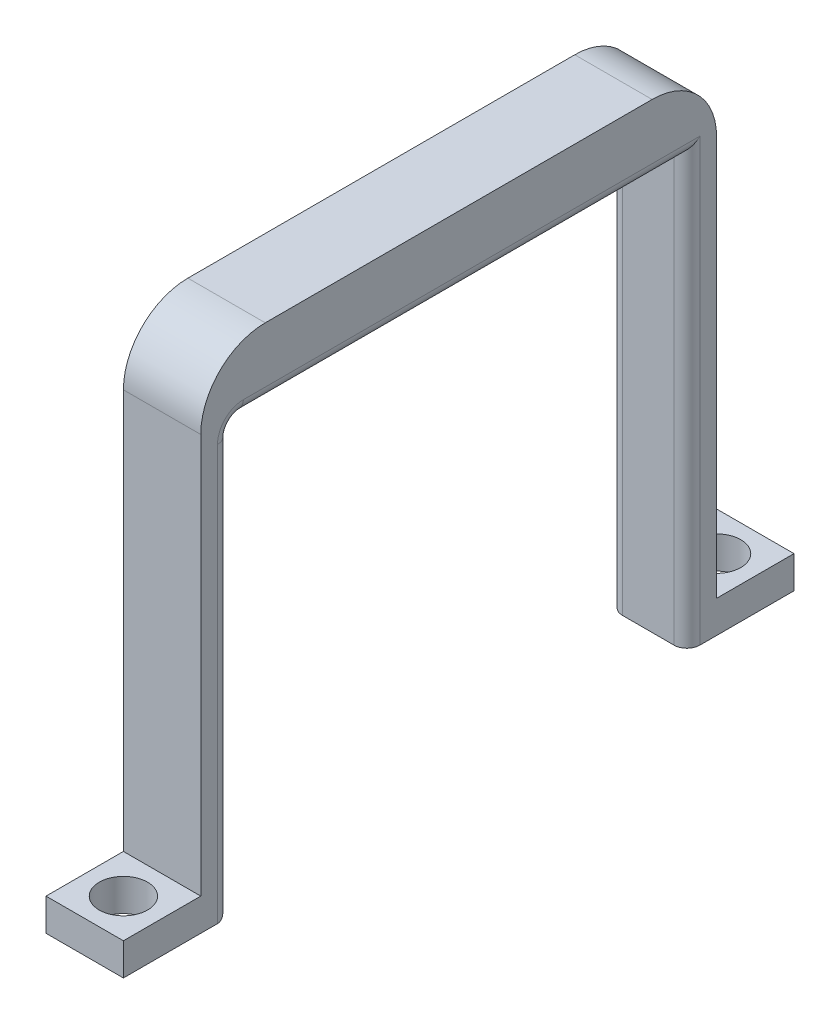
from build123d import *

# Parameters (mm, degrees)
BOSS_EXTRUDE1_DEPTH = 15.24
FILLET1_R           = 12.7
SKETCH2_R           = 4.7625
CUT_EXTRUDE1_DEPTH  = 17.78
FILLET2_R           = 2.54
LPATTERN1_COUNT     = 2
LPATTERN1_PITCH     = 116.84


with BuildPart() as part:
    # Sketch1 → Boss-Extrude1 (new body)
    with BuildSketch(Plane(origin=(0, 0, 0), x_dir=(0, 0, -1), z_dir=(1, 0, 0))):
        Polygon((0, 6.35), (0, 0), (21.082, 0), (21.082, 6.35), (21.082, 84.288418695), (110.998, 84.288418695), (110.998, 0), (132.08, 0), (132.08, 6.35), (116.84, 6.35), (116.84, 97.79), (15.24, 97.79), (15.24, 6.35), align=None)
    extrude(amount=BOSS_EXTRUDE1_DEPTH)

    # Fillet1
    fillet1_edges = [part.edges().sort_by_distance(p)[0] for p in [
        (7.62, 97.79, -15.24),
        (7.62, 97.79, -116.84),
    ]]
    fillet(fillet1_edges, radius=FILLET1_R)

    # Sketch2 → Cut-Extrude1 (cut)
    with BuildSketch(Plane(origin=(0, 6.35, 0), x_dir=(1, 0, 0), z_dir=(0, 1, 0))):
        with Locations(Location((7.62, 7.62, 0), (0, 0, 270))):
            Circle(SKETCH2_R)
    cut_extrude1 = extrude(amount=-CUT_EXTRUDE1_DEPTH, mode=Mode.SUBTRACT)

    # Fillet2
    fillet2_edges = [part.edges().sort_by_distance(p)[0] for p in [
        (15.24, 84.288418695, -66.04),
        (15.24, 42.144209348, -110.998),
        (0, 42.144209348, -110.998),
        (0, 84.288418695, -66.04),
        (0, 42.144209348, -21.082),
        (7.62, 0, -21.082),
        (7.62, 84.288418695, -21.082),
        (15.24, 42.144209348, -21.082),
    ]]
    fillet(fillet2_edges, radius=FILLET2_R)

    # LPattern1: Cut-Extrude1 ×2
    with Locations(*[(0, 0, -i * LPATTERN1_PITCH) for i in range(1, LPATTERN1_COUNT)]):
        add(cut_extrude1, mode=Mode.SUBTRACT)


solid = part.part
